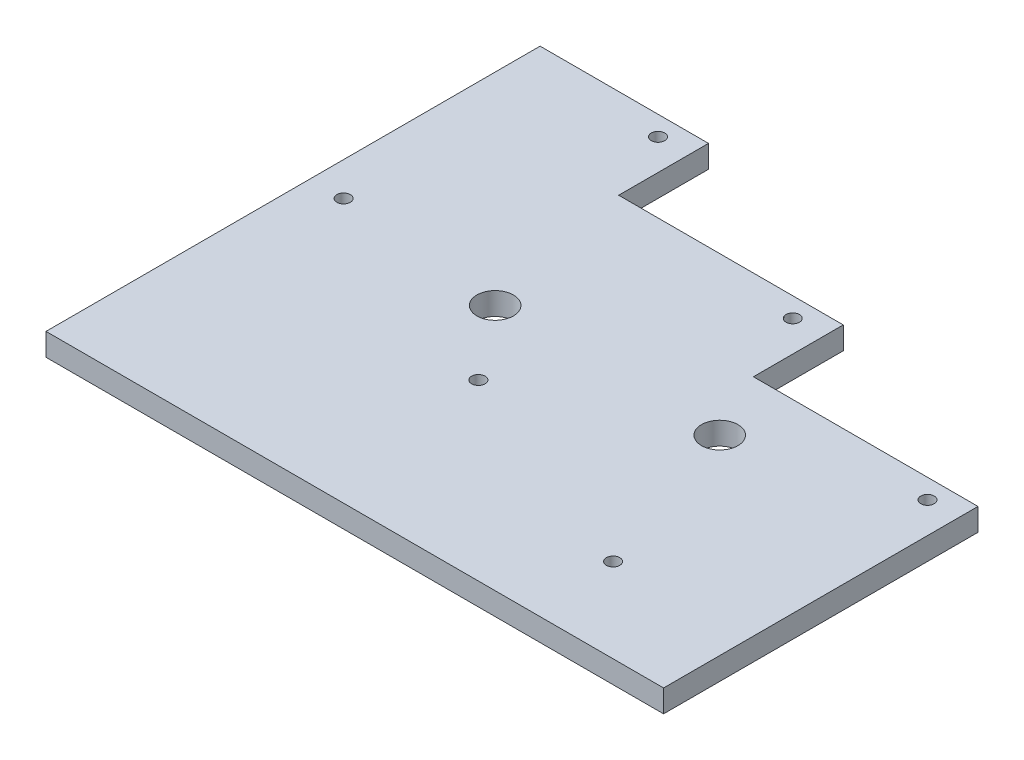
from build123d import *

# Parameters (mm, degrees)
BOSS_EXTRUDE1_DEPTH = 3.175
CUT_EXTRUDE2_START  = 3.175
SKETCH2_R           = 5.1562
CUT_EXTRUDE2_DEPTH  = 116.03462534
CUT_EXTRUDE4_START  = 3.175
SKETCH3_R           = 1.89865
CUT_EXTRUDE4_DEPTH  = 12.7


with BuildPart() as part:
    # Sketch1 → Boss-Extrude1 (new, symmetric)
    with BuildSketch(Plane(origin=(0, 0, 0), x_dir=(1, 0, 0), z_dir=(0, 1, 0))):
        Polygon((-87.3125, -69.85), (87.3125, -69.85), (87.3125, 19.05), (23.8125, 19.05), (23.8125, 44.45), (-39.6875, 44.45), (-39.6875, 69.85), (-87.3125, 69.85), align=None)
    extrude(amount=BOSS_EXTRUDE1_DEPTH, both=True)

    # Sketch2 → Cut-Extrude2 (cut, through all)
    with BuildSketch(Plane(origin=(0, 0, 0), x_dir=(1, 0, 0), z_dir=(0, 1, 0)).offset(CUT_EXTRUDE2_START)):
        with Locations(Location((-30.1625, 0, 0), (0, 0, 270))):
            Circle(SKETCH2_R)
        with Locations(Location((33.3375, 0, 0), (0, 0, 270))):
            Circle(SKETCH2_R)
    extrude(amount=-CUT_EXTRUDE2_DEPTH, mode=Mode.SUBTRACT)

    # Sketch3 → Cut-Extrude4 (cut)
    with BuildSketch(Plane(origin=(0, 0, 0), x_dir=(1, 0, 0), z_dir=(0, 1, 0)).offset(CUT_EXTRUDE4_START)):
        with Locations(Location((-77.7875, 4.7752, 0), (0, 0, 270))):
            Circle(SKETCH3_R)
        with Locations(Location((-48.4251, 64.3128, 0), (0, 0, 270))):
            Circle(SKETCH3_R)
        with Locations(Location((-14.2875, -20.6248, 0), (0, 0, 270))):
            Circle(SKETCH3_R)
        with Locations(Location((15.0749, 38.9128, 0), (0, 0, 270))):
            Circle(SKETCH3_R)
        with Locations(Location((49.2125, -46.0248, 0), (0, 0, 270))):
            Circle(SKETCH3_R)
        with Locations(Location((78.5749, 13.5128, 0), (0, 0, 270))):
            Circle(SKETCH3_R)
    extrude(amount=-CUT_EXTRUDE4_DEPTH, mode=Mode.SUBTRACT)


solid = part.part
